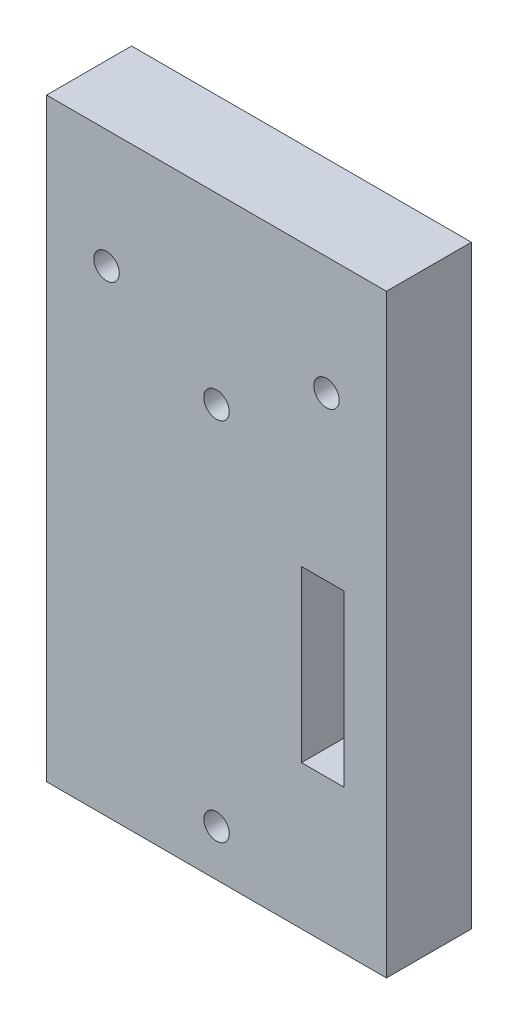
from build123d import *

# Parameters (mm, degrees)
SKETCH_1_W      = 40
SKETCH_1_H      = 70
SKETCH_1_R      = 1.5
SKETCH_1_W_2    = 5
SKETCH_1_H_2    = 20
EXTRUDE_1_DEPTH = 10


with BuildPart() as part:
    # 草圖1 → 伸長1 (new body)
    with BuildSketch(Plane.XY):
        with Locations((0, 8.046617977)):
            Rectangle(SKETCH_1_W, SKETCH_1_H)
        with Locations((12.945335117, 29.143070151)):
            Circle(SKETCH_1_R, mode=Mode.SUBTRACT)
        with Locations((-12.945335117, 29.143070151)):
            Circle(SKETCH_1_R, mode=Mode.SUBTRACT)
        with Locations((0, -21.5)):
            Circle(SKETCH_1_R, mode=Mode.SUBTRACT)
        with Locations((0, 21.5)):
            Circle(SKETCH_1_R, mode=Mode.SUBTRACT)
        with Locations((12.5, 0)):
            Rectangle(SKETCH_1_W_2, SKETCH_1_H_2, mode=Mode.SUBTRACT)
    extrude(amount=EXTRUDE_1_DEPTH)


solid = part.part
